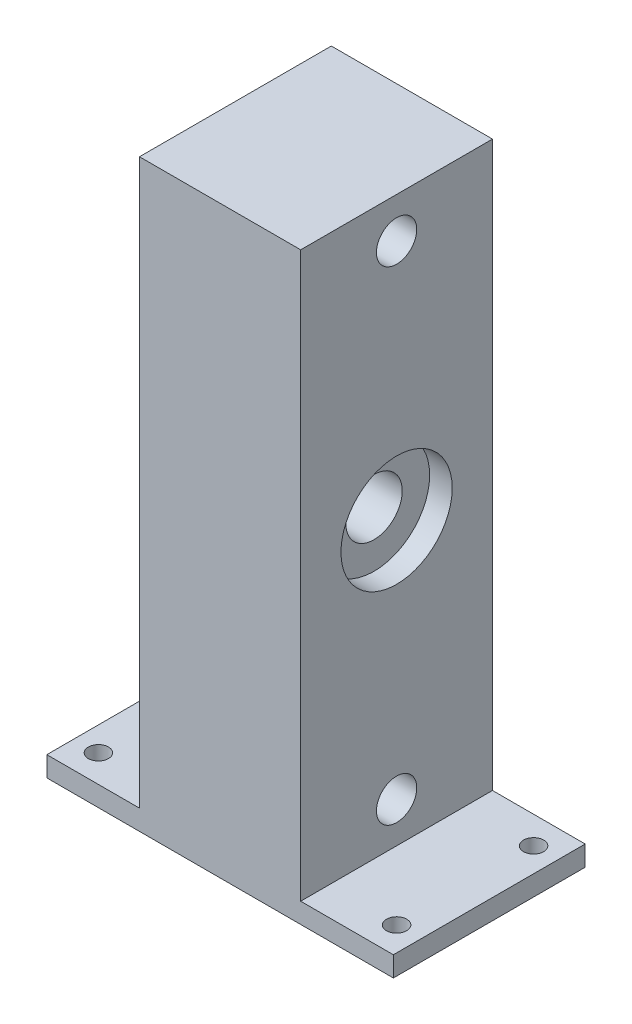
from build123d import *

# Parameters (mm, degrees)
SKETCH1_W           = 25.4
SKETCH1_H           = 88.9
BOSS_EXTRUDE1_DEPTH = 30.226
SKETCH2_R           = 3.175
CUT_EXTRUDE1_DEPTH  = 12.7
SKETCH3_R           = 8.763
CUT_EXTRUDE2_DEPTH  = 3.556
CUT_EXTRUDE3_START  = -21.844
SKETCH4_R           = 10.795
CUT_EXTRUDE3_DEPTH  = 21.844
SKETCH5_W           = 54.61
SKETCH5_H           = 30.226
BOSS_EXTRUDE2_DEPTH = 3.175
SKETCH6_R           = 1.5875
CUT_EXTRUDE4_DEPTH  = 3.175
BOSS_EXTRUDE3_START = 2.54
SKETCH8_R           = 10.795
SKETCH8_R_2         = 6.35
BOSS_EXTRUDE3_DEPTH = 2.54
BOSS_EXTRUDE4_START = 19.304
SKETCH9_R           = 10.795
BOSS_EXTRUDE4_DEPTH = 19.304
SKETCH10_R          = 8.763
BOSS_EXTRUDE5_DEPTH = 10.16
SKETCH12_R          = 4.445
CUT_EXTRUDE5_DEPTH  = 12.7


with BuildPart() as part:
    # Sketch1 → Boss-Extrude1 (new body)
    with BuildSketch(Plane.XY):
        Rectangle(SKETCH1_W, SKETCH1_H)
    extrude(amount=BOSS_EXTRUDE1_DEPTH)

    # Sketch2 → Cut-Extrude1 (cut)
    with BuildSketch(Plane(origin=(12.7, 0, 0), x_dir=(0, 0, -1), z_dir=(1, 0, 0))):
        with Locations((-15.113, 38.1)):
            Circle(SKETCH2_R)
        with Locations((-15.113, -38.1)):
            Circle(SKETCH2_R)
    extrude(amount=-CUT_EXTRUDE1_DEPTH, mode=Mode.SUBTRACT)

    # Sketch3 → Cut-Extrude2 (cut)
    with BuildSketch(Plane(origin=(12.7, 0, 0), x_dir=(0, 0, -1), z_dir=(1, 0, 0))):
        with Locations((-15.113, 0)):
            Circle(SKETCH3_R)
    extrude(amount=-CUT_EXTRUDE2_DEPTH, mode=Mode.SUBTRACT)

    # Sketch4 → Cut-Extrude3 (cut)
    with BuildSketch(Plane(origin=(9.144, 0, 0), x_dir=(0, 0, -1), z_dir=(1, 0, 0)).offset(CUT_EXTRUDE3_START)):
        with Locations((-15.113, 0)):
            Circle(SKETCH4_R)
    extrude(amount=CUT_EXTRUDE3_DEPTH, mode=Mode.SUBTRACT)

    # Sketch5 → Boss-Extrude2 (add)
    with BuildSketch(Plane.XZ.offset(44.45)):
        with Locations((0, 15.113)):
            Rectangle(SKETCH5_W, SKETCH5_H)
    extrude(amount=BOSS_EXTRUDE2_DEPTH)

    # Sketch6 → Cut-Extrude4 (cut)
    with BuildSketch(Plane.XZ.offset(47.625)):
        with Locations(Location((-23.495, 25.908, 0), (0, 0, 270))):
            Circle(SKETCH6_R)
        with Locations(Location((-23.495, 4.318, 0), (0, 0, 270))):
            Circle(SKETCH6_R)
        with Locations(Location((23.495, 4.318, 0), (0, 0, 270))):
            Circle(SKETCH6_R)
        with Locations(Location((23.495, 25.908, 0), (0, 0, 270))):
            Circle(SKETCH6_R)
    extrude(amount=-CUT_EXTRUDE4_DEPTH, mode=Mode.SUBTRACT)

    # Sketch8 → Boss-Extrude3 (add)
    with BuildSketch(Plane.ZY.offset(-9.144).offset(BOSS_EXTRUDE3_START)):
        with Locations(Location((15.113, 0, 0), (0, 0, 180))):
            Circle(SKETCH8_R)
        with Locations((15.113, 0)):
            Circle(SKETCH8_R_2, mode=Mode.SUBTRACT)
    extrude(amount=-BOSS_EXTRUDE3_DEPTH)

    # Sketch9 → Boss-Extrude4 (add)
    with BuildSketch(Plane.ZY.offset(-6.604).offset(BOSS_EXTRUDE4_START)):
        with Locations((15.113, 0)):
            Circle(SKETCH9_R)
    extrude(amount=-BOSS_EXTRUDE4_DEPTH)

    # Sketch10 → Boss-Extrude5 (add)
    with BuildSketch(Plane(origin=(9.144, 0, 0), x_dir=(0, 0, -1), z_dir=(1, 0, 0))):
        with Locations((-15.113, 0)):
            Circle(SKETCH10_R)
    extrude(amount=-BOSS_EXTRUDE5_DEPTH)

    # Sketch12 → Cut-Extrude5 (cut)
    with BuildSketch(Plane(origin=(12.7, 0, 0), x_dir=(0, 0, -1), z_dir=(1, 0, 0))):
        with Locations((-15.113, 0)):
            Circle(SKETCH12_R)
    extrude(amount=-CUT_EXTRUDE5_DEPTH, mode=Mode.SUBTRACT)


solid = part.part
